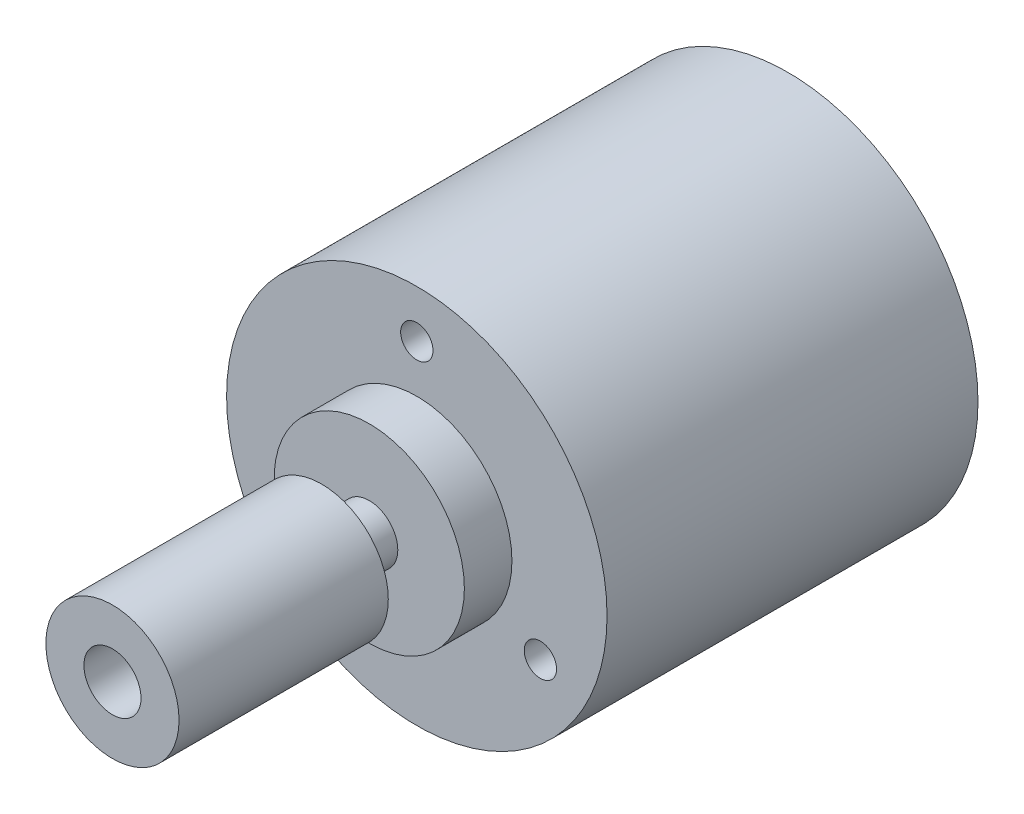
from build123d import *

# Parameters (mm, degrees)
SKETCH1_R                = 20
BOSS_EXTRUDE1_DEPTH      = 39
SKETCH2_R                = 10
BOSS_EXTRUDE2_DEPTH      = 5
SKETCH7_R                = 3
BOSS_EXTRUDE3_DEPTH      = 5
BOSS_EXTRUDE4_DEPTH      = 10
M3_CLEARANCE_HOLE2_D     = 3.4
M3_CLEARANCE_HOLE2_DEPTH = 7
M3_CLEARANCE_HOLE2_TIP   = 1.021463052
SKETCH15_R               = 7
BOSS_EXTRUDE9_DEPTH      = 22
CUT_EXTRUDE3_START       = -12
SKETCH18_R               = 3
CUT_EXTRUDE3_DEPTH       = 12


with BuildPart() as part:
    # Sketch1 → Boss-Extrude1 (new body)
    with BuildSketch(Plane.XY):
        Circle(SKETCH1_R)
    extrude(amount=-BOSS_EXTRUDE1_DEPTH)

    # Sketch2 → Boss-Extrude2 (add)
    with BuildSketch(Plane.XY):
        Circle(SKETCH2_R)
    extrude(amount=BOSS_EXTRUDE2_DEPTH)

    # Sketch7 → Boss-Extrude3 (add)
    with BuildSketch(Plane.XY.offset(5)):
        Circle(SKETCH7_R)
    extrude(amount=BOSS_EXTRUDE3_DEPTH)

    # Sketch9 → Boss-Extrude4 (add)
    with BuildSketch(Plane.XY.offset(10)):
        with BuildLine():
            Line((-2.236067977, 2), (2.236067977, 2))
            ThreePointArc((2.236067977, 2), (0, -3), (-2.236067977, 2))
        make_face()
    extrude(amount=BOSS_EXTRUDE4_DEPTH)

    # M3 Clearance Hole2
    with Locations(Plane.XY):
        with Locations((0, 15), (12.991881057, -7.499133975), (-12.988881057, -7.500866025)):
            Hole(M3_CLEARANCE_HOLE2_D / 2, depth=M3_CLEARANCE_HOLE2_DEPTH)
            with Locations((0, 0, -(M3_CLEARANCE_HOLE2_DEPTH + M3_CLEARANCE_HOLE2_TIP / 2))):  # 118° drill point
                Cone(0, M3_CLEARANCE_HOLE2_D / 2, M3_CLEARANCE_HOLE2_TIP, mode=Mode.SUBTRACT)

    # Sketch15 → Boss-Extrude9 (add)
    with BuildSketch(Plane.XY.offset(10)):
        Circle(SKETCH15_R)
        with BuildLine():
            Line((-2.236067977, 2), (2.236067977, 2))
            ThreePointArc((2.236067977, 2), (0, -3), (-2.236067977, 2))
        make_face(mode=Mode.SUBTRACT)
    extrude(amount=BOSS_EXTRUDE9_DEPTH)

    # Sketch18 → Cut-Extrude3 (cut)
    with BuildSketch(Plane.XY.offset(32).offset(CUT_EXTRUDE3_START)):
        Circle(SKETCH18_R)
    extrude(amount=CUT_EXTRUDE3_DEPTH, mode=Mode.SUBTRACT)


solid = part.part
